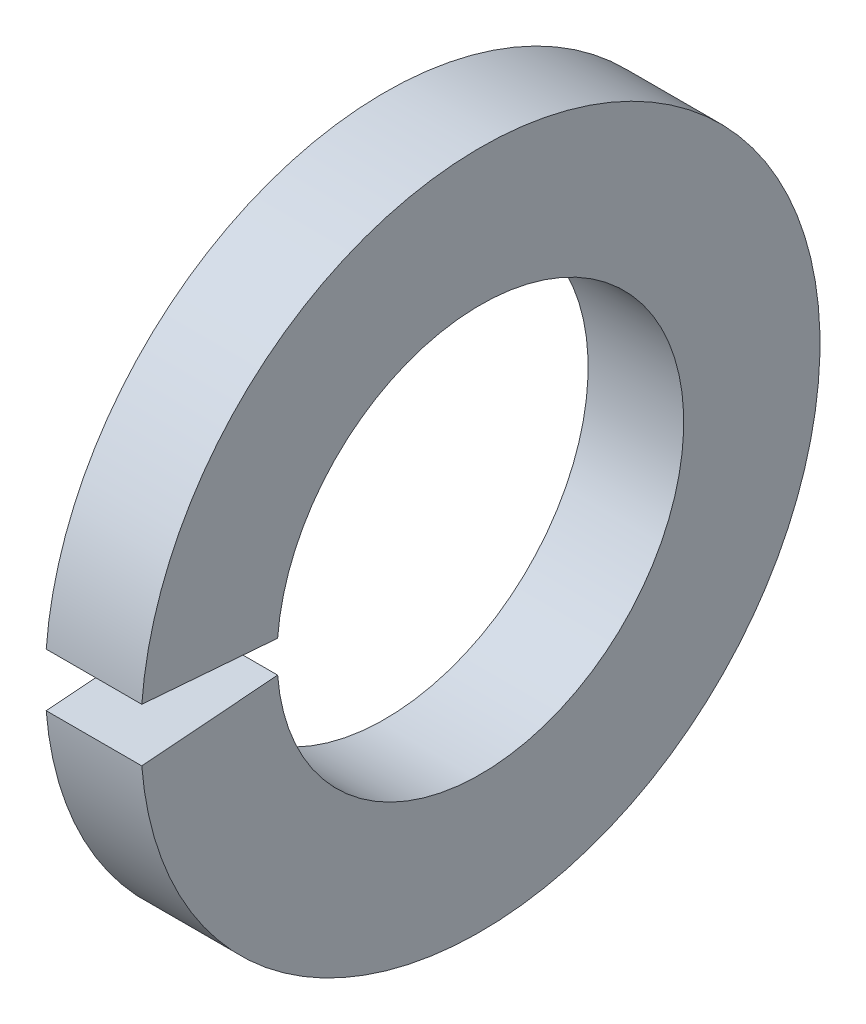
from build123d import *

# Parameters (mm, degrees)
SKETCH1_W      = 1.1938
SKETCH1_H      = 1.7018
REVOLVE1_ANGLE = 351


with BuildPart() as part:
    # Sketch1 → Revolve1 (revolve)
    with BuildSketch(Plane(origin=(0, 0, 0), x_dir=(-1, 0, 0), z_dir=(0, 0.996917333733128, 0.07845909572784565))):
        with Locations((0.5969, 3.3909)):
            Rectangle(SKETCH1_W, SKETCH1_H)
    revolve(axis=Axis((0, 0, 0), (1, 0, 0)), revolution_arc=REVOLVE1_ANGLE)


solid = part.part
